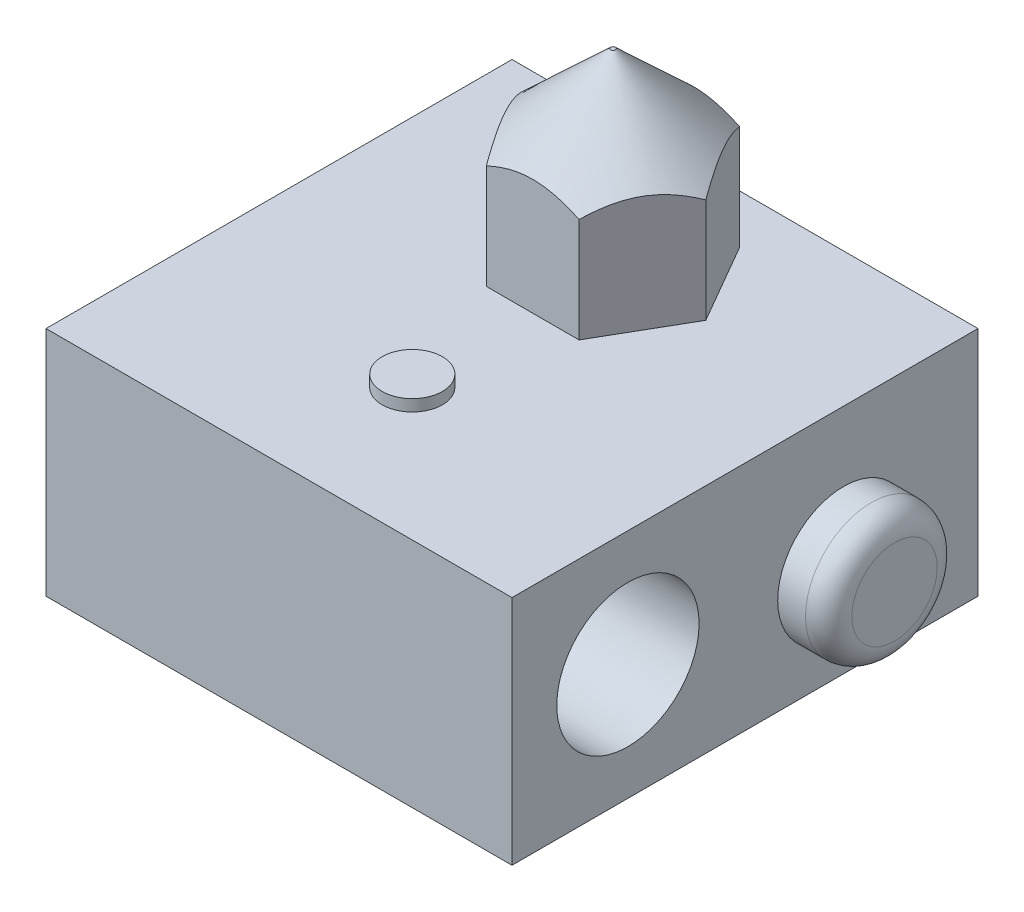
from build123d import *

# Parameters (mm, degrees)
SKETCH1_W           = 20.1
SKETCH1_H           = 20.1
BOSS_EXTRUDE1_DEPTH = 10
BOSS_EXTRUDE2_DEPTH = 8.15
SKETCH4_R           = 3.07
CUT_EXTRUDE1_DEPTH  = 34.725991461
SKETCH5_R           = 2.84
BOSS_EXTRUDE3_DEPTH = 2.2
FILLET1_R           = 1
SKETCH6_R           = 2.675
CUT_EXTRUDE2_DEPTH  = 5.15
SKETCH7_R           = 1.3
BOSS_EXTRUDE4_DEPTH = 0.5


with BuildPart() as part:
    # Sketch1 → Boss-Extrude1 (new body)
    with BuildSketch(Plane(origin=(0, 0, 0), x_dir=(1, 0, 0), z_dir=(0, 1, 0))):
        with Locations((-10.05, 10.05)):
            Rectangle(SKETCH1_W, SKETCH1_H)
    extrude(amount=BOSS_EXTRUDE1_DEPTH)

    # Sketch2 → Boss-Extrude2 (add)
    with BuildSketch(Plane(origin=(0, 10, 0), x_dir=(1, 0, 0), z_dir=(0, 1, 0))):
        Polygon((-8.177760508, 18), (-12.178797874, 18), (-14.179316556, 14.535), (-12.178797874, 11.07), (-8.177760508, 11.07), (-6.177241825, 14.535), align=None)
    extrude(amount=BOSS_EXTRUDE2_DEPTH)

    # Sketch3 → Cut-Revolve1 (revolve, cut)
    with BuildSketch(Plane(origin=(0, 0, -14.535), x_dir=(-1, 0, 0), z_dir=(0, 0, -1)), mode=Mode.PRIVATE) as cut_revolve1_sk:
        Polygon((10.278279191, 18.15), (14.179316556, 14.5), (16.20190306, 12.607569847), (16.20190306, 19.465321923), (10.278279191, 19.465321923), align=None)
    revolve(cut_revolve1_sk.sketch.rotate(Axis((-10.178279191, 18.15, -14.535), (0, 1, 0)), 270), axis=Axis((-10.178279191, 18.15, -14.535), (0, 1, 0)), mode=Mode.SUBTRACT)

    # Sketch4 → Cut-Extrude1 (cut, through all)
    with BuildSketch(Plane(origin=(0, 0, 0), x_dir=(0, 0, -1), z_dir=(1, 0, 0))):
        with Locations((5, 5)):
            Circle(SKETCH4_R)
    extrude(amount=-CUT_EXTRUDE1_DEPTH, mode=Mode.SUBTRACT)

    # Sketch5 → Boss-Extrude3 (add)
    with BuildSketch(Plane.ZY):
        with Locations((-14.3, 4.16)):
            Circle(SKETCH5_R)
    extrude(amount=-BOSS_EXTRUDE3_DEPTH)

    # Fillet1
    fillet1_edges = [part.edges().sort_by_distance(p)[0] for p in [
        (2.2, 4.16, -17.14),
    ]]
    fillet(fillet1_edges, radius=FILLET1_R)

    # Sketch6 → Cut-Extrude2 (cut)
    with BuildSketch(Plane.XZ):
        with Locations(Location((-10.178279191, -14.535, 0), (0, 0, 270))):
            Circle(SKETCH6_R)
    extrude(amount=-CUT_EXTRUDE2_DEPTH, mode=Mode.SUBTRACT)

    # Sketch7 → Boss-Extrude4 (add)
    with BuildSketch(Plane(origin=(0, 10, 0), x_dir=(1, 0, 0), z_dir=(0, 1, 0))):
        with Locations(Location((-10, 5.7, 0), (0, 0, 270))):
            Circle(SKETCH7_R)
    extrude(amount=BOSS_EXTRUDE4_DEPTH)


solid = part.part
